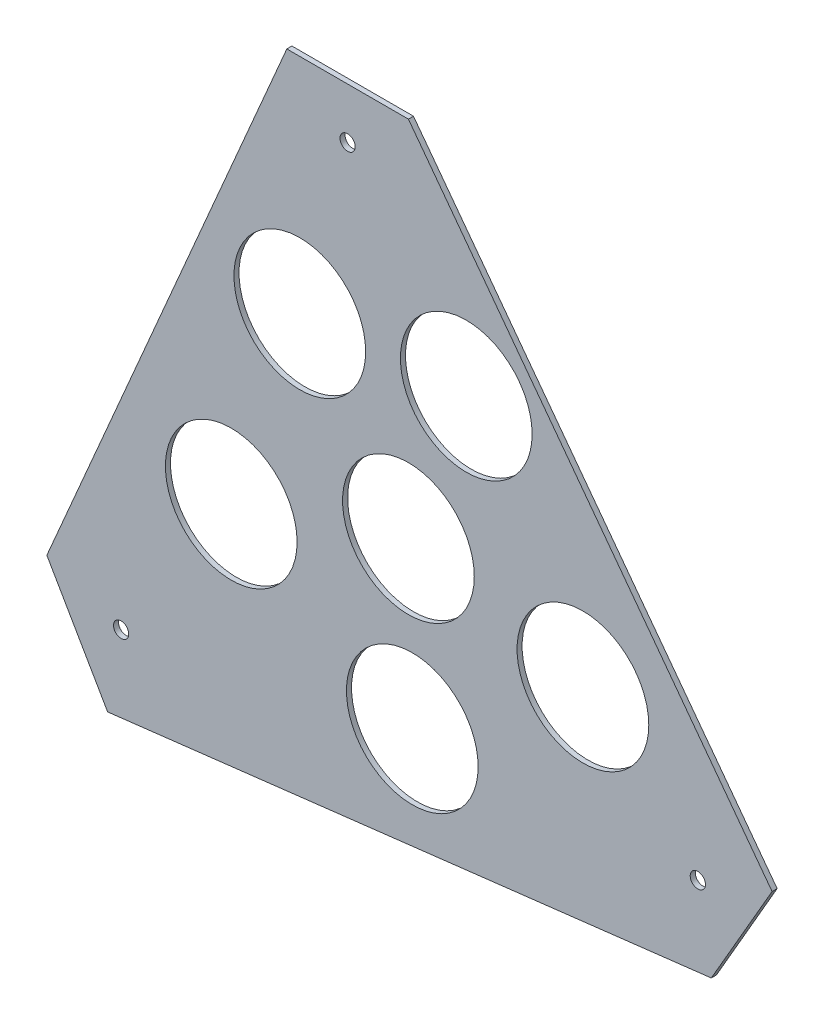
from build123d import *

# Parameters (mm, degrees)
CROQUIS1_R              = 1.5
CROQUIS1_R_2            = 13
SALIENTE_EXTRUIR1_DEPTH = 1


with BuildPart() as part:
    # Croquis1 → Saliente-Extruir1 (new body)
    with BuildSketch(Plane.XY):
        Polygon((75.653759451, -20.425021584), (63.653759451, -41.209631274), (-55.51546729, -55.305566785), (-67.51546729, -34.520957094), (-20.138292161, 75.730588368), (3.861707839, 75.730588368), align=None)
        with Locations((-8.138292161, 65.730588368)):
            Circle(CROQUIS1_R, mode=Mode.SUBTRACT)
        with Locations((60.993505413, -25.817326429)):
            Circle(CROQUIS1_R, mode=Mode.SUBTRACT)
        with Locations((-52.855213252, -39.913261939)):
            Circle(CROQUIS1_R, mode=Mode.SUBTRACT)
        with Locations((-17.580280051, 31.743495557)):
            Circle(CROQUIS1_R_2, mode=Mode.SUBTRACT)
        with Locations((15.280535098, 34.073315968)):
            Circle(CROQUIS1_R_2, mode=Mode.SUBTRACT)
        with Locations((38.308858253, -4.130398412)):
            Circle(CROQUIS1_R_2, mode=Mode.SUBTRACT)
        with Locations((3.861707839, 4.011492021)):
            Circle(CROQUIS1_R_2, mode=Mode.SUBTRACT)
        with Locations((4.62875153, -28.110955522)):
            Circle(CROQUIS1_R_2, mode=Mode.SUBTRACT)
        with Locations((-31.112309288, -7.578469648)):
            Circle(CROQUIS1_R_2, mode=Mode.SUBTRACT)
    extrude(amount=SALIENTE_EXTRUIR1_DEPTH)


solid = part.part
